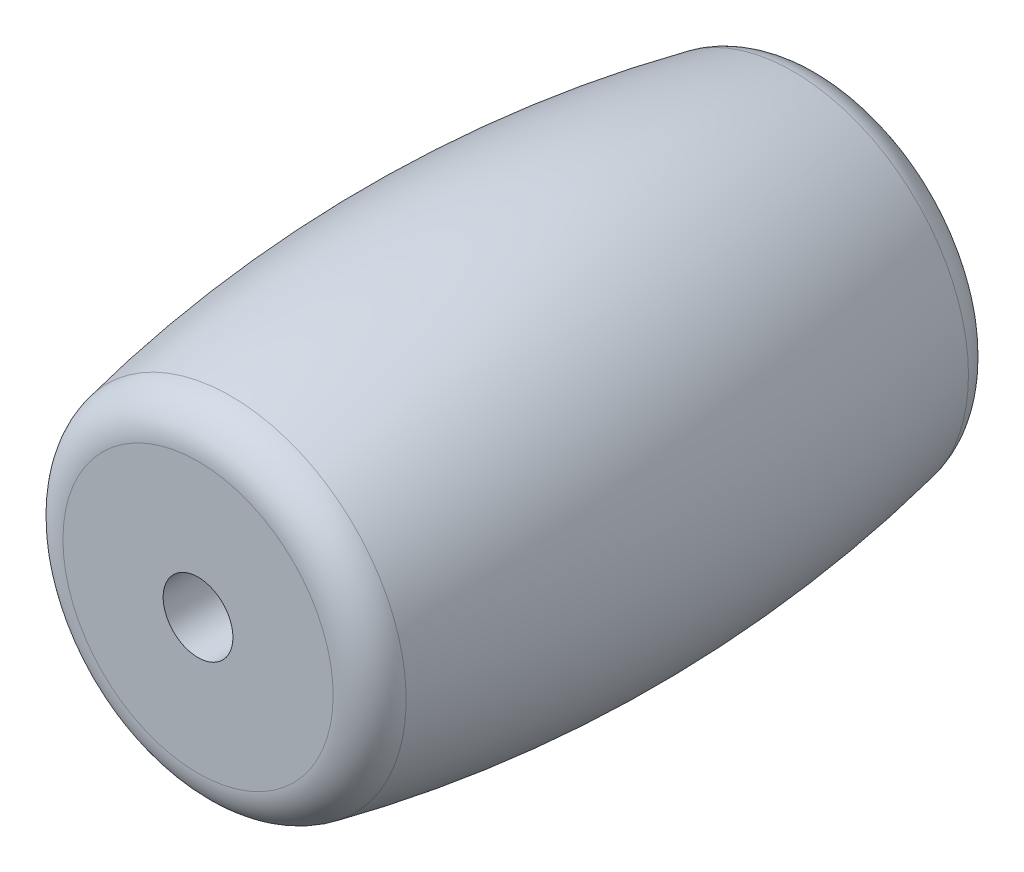
from build123d import *

# Parameters (mm, degrees)
VERRUNDUNG1_R = 2


with BuildPart() as part:
    # Skizze1 → Rotation1 (revolve)
    with BuildSketch(Plane(origin=(0, 0, 0), x_dir=(0, 0, -1), z_dir=(1, 0, 0)), mode=Mode.PRIVATE) as rotation1_sk:
        with BuildLine():
            Line((-15.3, 3.010167596), (15.3, 3.010167596))
            Line((15.3, 3.010167596), (15.3, 9.504229472))
            ThreePointArc((15.3, 9.504229472), (0, 11.24917218), (-15.3, 9.504229472))
            Line((-15.3, 9.504229472), (-15.3, 3.010167596))
        make_face()
    revolve(rotation1_sk.sketch.rotate(Axis((0, 1.310167596, 18.851269556), (0, 0, -1)), 90), axis=Axis((0, 1.310167596, 18.851269556), (0, 0, -1)))

    # Verrundung1
    verrundung1_edges = [part.edges().sort_by_distance(p)[0] for p in [
        (-8.194061877, 1.310167596, 15.3),
        (-8.194061877, 1.310167596, -15.3),
    ]]
    fillet(verrundung1_edges, radius=VERRUNDUNG1_R)


solid = part.part
